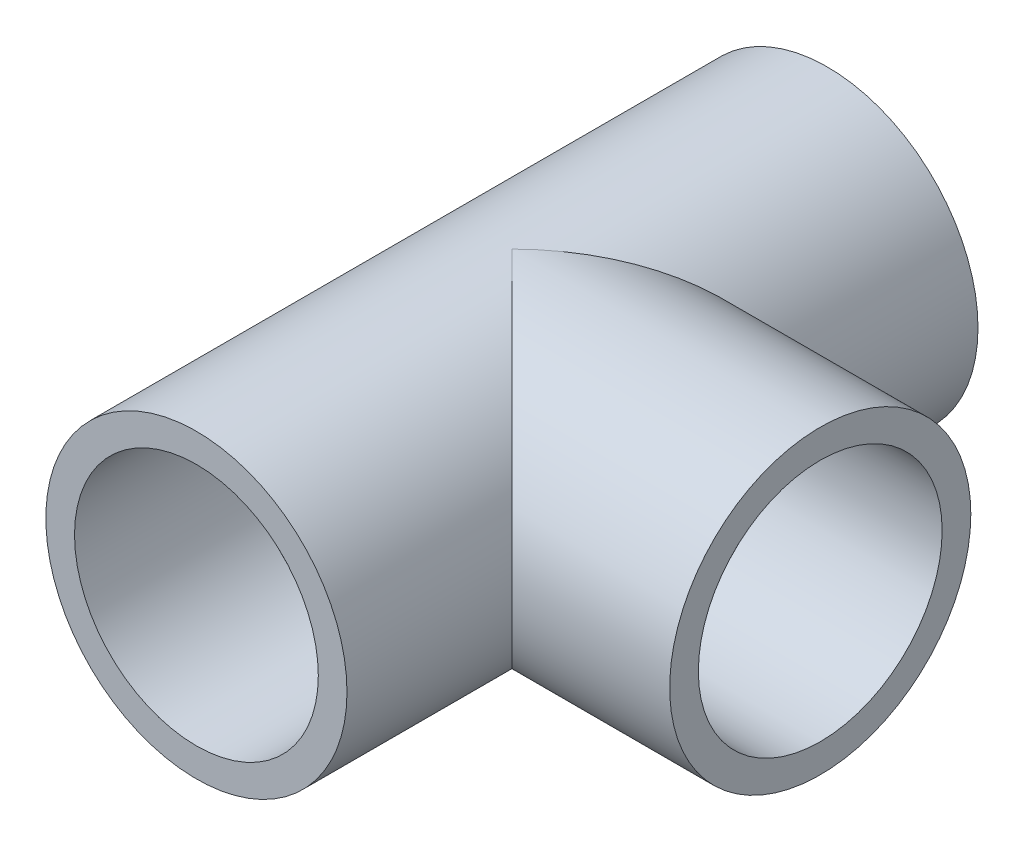
from build123d import *

# Parameters (mm, degrees)
SKETCH1_R           = 16.66875
BOSS_EXTRUDE1_DEPTH = 69.85
SKETCH2_R           = 16.66875
BOSS_EXTRUDE2_DEPTH = 34.13125
SKETCH3_R           = 12.7
CUT_EXTRUDE1_DEPTH  = 30.48
SKETCH5_R           = 12.7
CUT_EXTRUDE3_DEPTH  = 80.509822998
SKETCH7_R           = 13.49375
CUT_EXTRUDE4_DEPTH  = 19.05
SKETCH8_R           = 13.49375
CUT_EXTRUDE5_DEPTH  = 19.05
CUT_EXTRUDE6_START  = -19.05
SKETCH9_R           = 13.49375
CUT_EXTRUDE6_DEPTH  = 19.05


with BuildPart() as part:
    # Sketch1 → Boss-Extrude1 (new body)
    with BuildSketch(Plane.XY):
        Circle(SKETCH1_R)
    extrude(amount=BOSS_EXTRUDE1_DEPTH)

    # Sketch2 → Boss-Extrude2 (add)
    with BuildSketch(Plane(origin=(0, 0, 0), x_dir=(0, 0, -1), z_dir=(1, 0, 0))):
        with Locations((-34.925, 0)):
            Circle(SKETCH2_R)
    extrude(amount=BOSS_EXTRUDE2_DEPTH)

    # Sketch3 → Cut-Extrude1 (cut)
    with BuildSketch(Plane(origin=(34.13125, 0, 0), x_dir=(0, 0, -1), z_dir=(1, 0, 0))):
        with Locations((-34.925, 0)):
            Circle(SKETCH3_R)
    extrude(amount=-CUT_EXTRUDE1_DEPTH, mode=Mode.SUBTRACT)

    # Sketch5 → Cut-Extrude3 (cut, through all)
    with BuildSketch(Plane(origin=(0, 0, 0), x_dir=(-1, 0, 0), z_dir=(0, 0, -1))):
        Circle(SKETCH5_R)
    extrude(amount=-CUT_EXTRUDE3_DEPTH, mode=Mode.SUBTRACT)

    # Sketch7 → Cut-Extrude4 (cut)
    with BuildSketch(Plane.XY.offset(69.85)):
        Circle(SKETCH7_R)
    extrude(amount=-CUT_EXTRUDE4_DEPTH, mode=Mode.SUBTRACT)

    # Sketch8 → Cut-Extrude5 (cut)
    with BuildSketch(Plane(origin=(34.13125, 0, 0), x_dir=(0, 0, -1), z_dir=(1, 0, 0))):
        with Locations((-34.925, 0)):
            Circle(SKETCH8_R)
    extrude(amount=-CUT_EXTRUDE5_DEPTH, mode=Mode.SUBTRACT)

    # Sketch9 → Cut-Extrude6 (cut)
    with BuildSketch(Plane(origin=(0, 0, 0), x_dir=(-1, 0, 0), z_dir=(0, 0, -1)).offset(CUT_EXTRUDE6_START)):
        with Locations(Location((0, 0, 0), (0, 0, 180))):
            Circle(SKETCH9_R)
    extrude(amount=CUT_EXTRUDE6_DEPTH, mode=Mode.SUBTRACT)


solid = part.part
